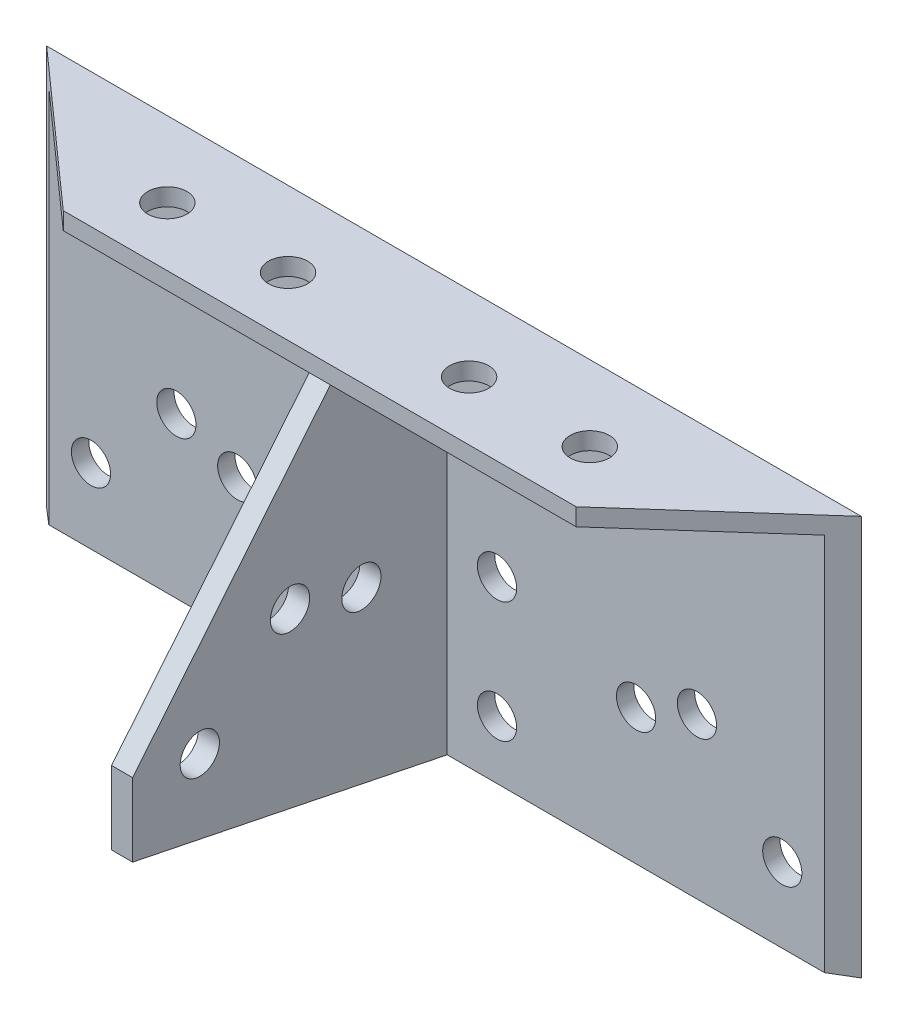
from build123d import *

# Parameters (mm, degrees)
SKETCH_1_W          = 540
SKETCH_1_H          = 265
SKETCH_1_R          = 13
EXTRUDE_548_DEPTH   = 11.5
SKETCH_2_W          = 540
SKETCH_2_H          = 11.5
EXTRUDE_1_DEPTH     = 77.5
CUT_EXTRUDE_1_DEPTH = 609.067430471
SKETCH_4_R          = 13
CUT_EXTRUDE_2_DEPTH = 609.067430471
SKETCH_5_W          = 14
SKETCH_5_H          = 253.5
EXTRUDE_2_DEPTH     = 208.5
SKETCH_6_R          = 13
CUT_EXTRUDE_3_DEPTH = 442.988687638
CUT_EXTRUDE_4_DEPTH = 442.988687638


with BuildPart() as part:
    # 草图1 → Extrude 548 (new body)
    with BuildSketch(Plane.XY):
        with Locations((270, 132.5)):
            Rectangle(SKETCH_1_W, SKETCH_1_H)
        with Locations((97.46594539, 108.46594539)):
            Circle(SKETCH_1_R, mode=Mode.SUBTRACT)
        with Locations((40.897402896, 51.897402896)):
            Circle(SKETCH_1_R, mode=Mode.SUBTRACT)
        with Locations(Location((499.102597104, 51.897402896, 0), (0, 0, 180))):
            Circle(SKETCH_1_R, mode=Mode.SUBTRACT)
        with Locations(Location((402.170987639, 92.261534081, 0), (0, 0, 180))):
            Circle(SKETCH_1_R, mode=Mode.SUBTRACT)
        with Locations((230, 121)):
            Circle(SKETCH_1_R, mode=Mode.SUBTRACT)
        with Locations((230, 41)):
            Circle(SKETCH_1_R, mode=Mode.SUBTRACT)
        with Locations(Location((310, 41, 0), (0, 0, 180))):
            Circle(SKETCH_1_R, mode=Mode.SUBTRACT)
        with Locations(Location((310, 121, 0), (0, 0, 180))):
            Circle(SKETCH_1_R, mode=Mode.SUBTRACT)
        with Locations((137.829012361, 92.261534081)):
            Circle(SKETCH_1_R, mode=Mode.SUBTRACT)
        with Locations(Location((442.53405461, 108.46594539, 0), (0, 0, 180))):
            Circle(SKETCH_1_R, mode=Mode.SUBTRACT)
    extrude(amount=EXTRUDE_548_DEPTH)

    # 草图2 → 凸台-拉伸1 (add)
    with BuildSketch(Plane.XY.offset(11.5)):
        with Locations((270, 259.25)):
            Rectangle(SKETCH_2_W, SKETCH_2_H)
    extrude(amount=EXTRUDE_1_DEPTH)

    # 草图3 → 切除-拉伸1 (cut, through all)
    with BuildSketch(Plane(origin=(0, 265, 0), x_dir=(-1, 0, 0), z_dir=(0, 1, 0))):
        Polygon((0, 0), (-100, 89), (0, 89), align=None)
        Polygon((-540, 0), (-440, 89), (-540, 89), align=None)
    extrude(amount=-CUT_EXTRUDE_1_DEPTH, mode=Mode.SUBTRACT)

    # 草图4 → 切除-拉伸2 (cut, through all)
    with BuildSketch(Plane(origin=(0, 265, 0), x_dir=(-1, 0, 0), z_dir=(0, 1, 0))):
        with Locations(Location((-210, 50, 0), (0, 0, 90))):
            Circle(SKETCH_4_R)
        with Locations(Location((-130, 50, 0), (0, 0, 90))):
            Circle(SKETCH_4_R)
        with Locations(Location((-410, 50, 0), (0, 0, 90))):
            Circle(SKETCH_4_R)
        with Locations(Location((-330, 50, 0), (0, 0, 90))):
            Circle(SKETCH_4_R)
    extrude(amount=-CUT_EXTRUDE_2_DEPTH, mode=Mode.SUBTRACT)

    # 草图5 → 凸台-拉伸2 (add)
    with BuildSketch(Plane.XY.offset(11.5)):
        with Locations((270, 126.75)):
            Rectangle(SKETCH_5_W, SKETCH_5_H)
    extrude(amount=EXTRUDE_2_DEPTH)

    # 草图6 → 切除-拉伸3 (cut, through all)
    with BuildSketch(Plane(origin=(277, 0, 0), x_dir=(0, 0, -1), z_dir=(1, 0, 0))):
        with Locations((-115.693003517, 138.161774652)):
            Circle(SKETCH_6_R)
        with Locations((-175.485749012, 85.012667545)):
            Circle(SKETCH_6_R)
        with Locations((-68.400421337, 126.93798921)):
            Circle(SKETCH_6_R)
        Polygon((-89, 253.5), (-220, 93.5), (-220, 253.5), align=None)
        Polygon((-220, 45), (0, 0), (-220, 0), align=None)
    extrude(amount=-CUT_EXTRUDE_3_DEPTH, mode=Mode.SUBTRACT)

    # 草图7 → 切除-拉伸4 (cut, through all)
    with BuildSketch(Plane.ZY.offset(-277)):
        Polygon((0, 0), (11.5, 2.352272727), (11.5, 0), align=None)
    extrude(amount=-CUT_EXTRUDE_4_DEPTH, mode=Mode.SUBTRACT)


solid = part.part
